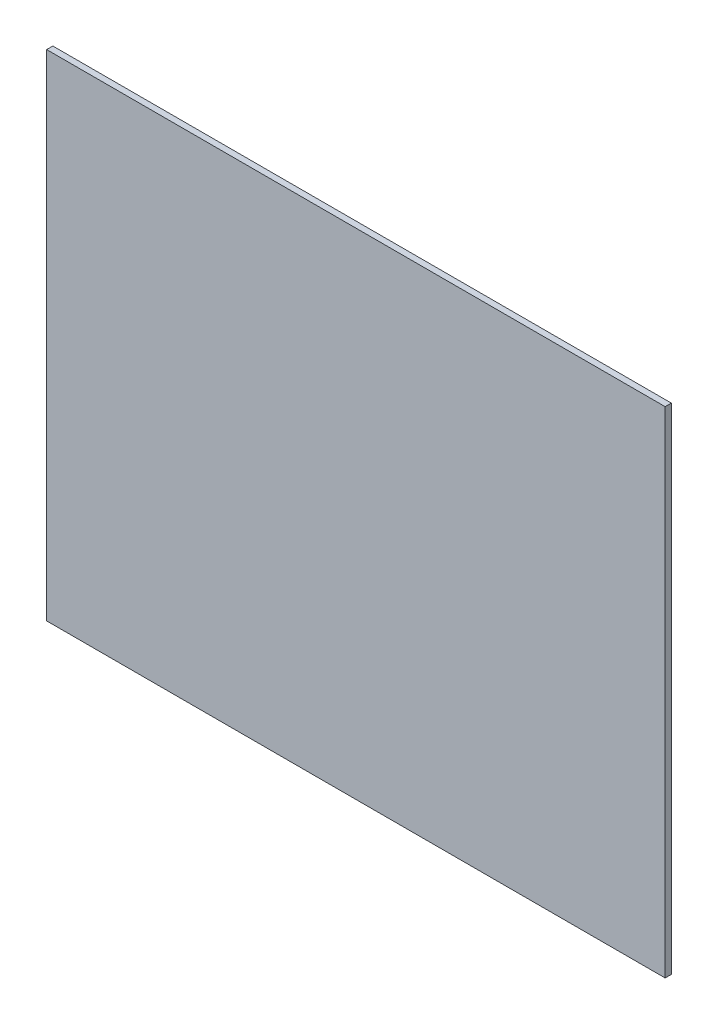
from build123d import *

# Parameters (mm, degrees)
ESQUISSE1_W        = 1000
ESQUISSE1_H        = 800
BOSS_EXTRU_1_DEPTH = 10


with BuildPart() as part:
    # Esquisse1 → Boss.-Extru.1 (new body)
    with BuildSketch(Plane.XY):
        with Locations((60.364308855, -148.983739837)):
            Rectangle(ESQUISSE1_W, ESQUISSE1_H)
    extrude(amount=BOSS_EXTRU_1_DEPTH)


solid = part.part
